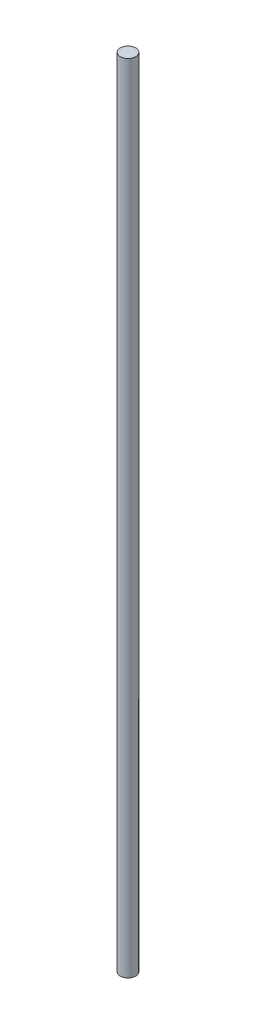
from build123d import *

# Parameters (mm, degrees)
SKETCH1_R           = 3.175
BOSS_EXTRUDE1_DEPTH = 330.2


with BuildPart() as part:
    # Sketch1 → Boss-Extrude1 (new body)
    with BuildSketch(Plane(origin=(0, 0, 0), x_dir=(1, 0, 0), z_dir=(0, 1, 0))):
        with Locations(Location((0, 0, 0), (0, 0, 270))):
            Circle(SKETCH1_R)
    extrude(amount=BOSS_EXTRUDE1_DEPTH)


solid = part.part
